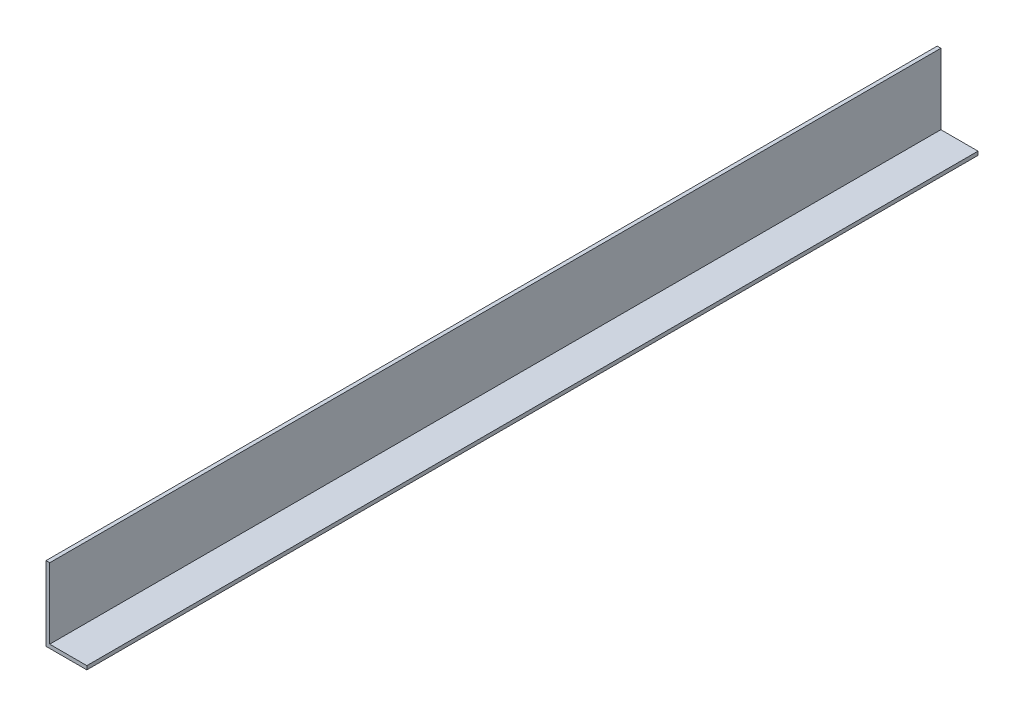
from build123d import *

# Parameters (mm, degrees)
BOSS_EXTRU_1_DEPTH = 240


with BuildPart() as part:
    # Esquisse1 → Boss.-Extru.1 (new body)
    with BuildSketch(Plane.XY):
        Polygon((0, 0), (0, 20), (1, 20), (1, 1), (11, 1), (11, 0), align=None)
    extrude(amount=BOSS_EXTRU_1_DEPTH)


solid = part.part
